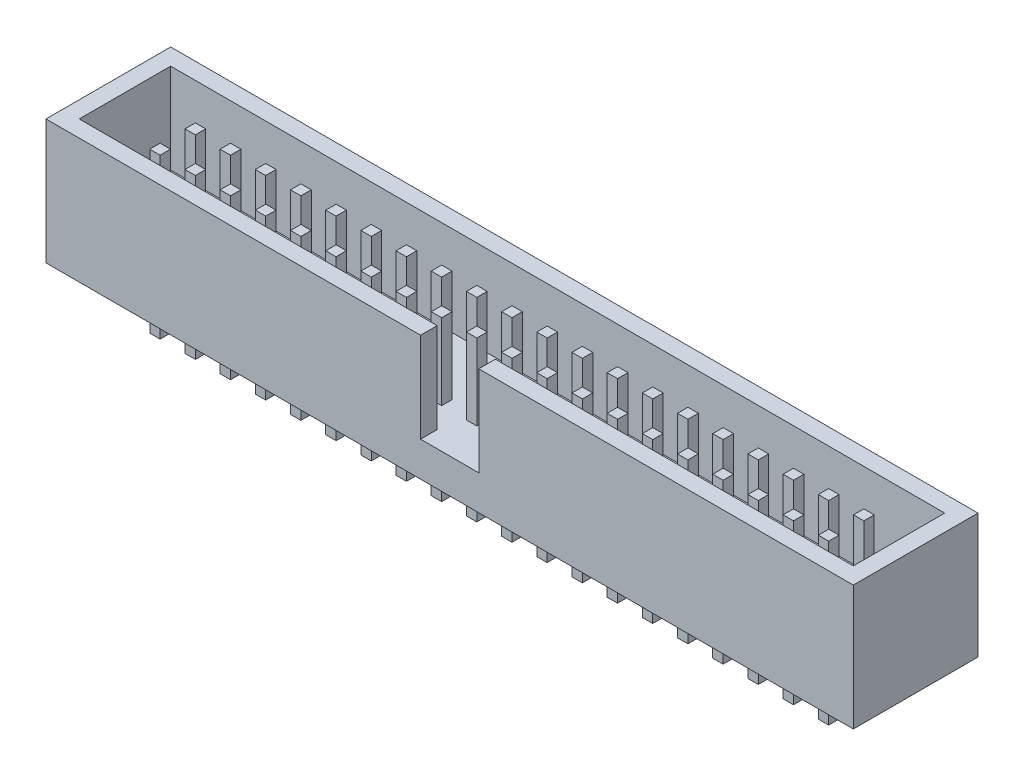
from build123d import *

# Parameters (mm, degrees)
SKETCH_1_W           = 58.28
SKETCH_1_H           = 9
EXTRUDE_1_DEPTH      = 9
SKETCH_2_W           = 55.88
SKETCH_2_H           = 6.6
CUT_EXTRUDE_1_DEPTH  = 6.5
SKETCH_3_W           = 4.2
SKETCH_3_H           = 6.5
CUT_EXTRUDE_2_DEPTH  = 6.5
EXTRUDE_2_DEPTH      = 3.5
EXTRUDE_2_DEPTH_BACK = 8
SKETCH_5_W           = 0.75
SKETCH_5_H           = 0.75


with BuildPart() as part:
    # 草图1 → 拉伸1 (new body)
    with BuildSketch(Plane(origin=(0, 0, 0), x_dir=(1, 0, 0), z_dir=(0, 1, 0))):
        Rectangle(SKETCH_1_W, SKETCH_1_H)
    extrude(amount=EXTRUDE_1_DEPTH)

    # 草图2 → 切除-拉伸1 (cut)
    with BuildSketch(Plane(origin=(0, 9, 0), x_dir=(-1, 0, 0), z_dir=(0, 1, 0))):
        Rectangle(SKETCH_2_W, SKETCH_2_H)
    extrude(amount=-CUT_EXTRUDE_1_DEPTH, mode=Mode.SUBTRACT)

    # 草图3 → 切除-拉伸2 (cut)
    with BuildSketch(Plane.XY.offset(4.5)):
        with Locations((0, 5.75)):
            Rectangle(SKETCH_3_W, SKETCH_3_H)
    extrude(amount=-CUT_EXTRUDE_2_DEPTH, mode=Mode.SUBTRACT)

    # 草图5 → 拉伸2 (add, two sides: drawn at the far end of the back side and taken through both)
    with BuildSketch(Plane.XZ.offset(-EXTRUDE_2_DEPTH_BACK)):
        with Locations((-1.27, 1.27)):
            Rectangle(SKETCH_5_W, SKETCH_5_H)
        with Locations((-3.81, 1.27)):
            Rectangle(SKETCH_5_W, SKETCH_5_H)
        with Locations((-6.35, 1.27)):
            Rectangle(SKETCH_5_W, SKETCH_5_H)
        with Locations((-8.89, 1.27)):
            Rectangle(SKETCH_5_W, SKETCH_5_H)
        with Locations((-8.89, -1.27)):
            Rectangle(SKETCH_5_W, SKETCH_5_H)
        with Locations((-6.35, -1.27)):
            Rectangle(SKETCH_5_W, SKETCH_5_H)
        with Locations((-3.81, -1.27)):
            Rectangle(SKETCH_5_W, SKETCH_5_H)
        with Locations((-1.27, -1.27)):
            Rectangle(SKETCH_5_W, SKETCH_5_H)
        with Locations((1.27, -1.27)):
            Rectangle(SKETCH_5_W, SKETCH_5_H)
        with Locations((3.81, -1.27)):
            Rectangle(SKETCH_5_W, SKETCH_5_H)
        with Locations((6.35, -1.27)):
            Rectangle(SKETCH_5_W, SKETCH_5_H)
        with Locations((8.89, -1.27)):
            Rectangle(SKETCH_5_W, SKETCH_5_H)
        with Locations((8.89, 1.27)):
            Rectangle(SKETCH_5_W, SKETCH_5_H)
        with Locations((6.35, 1.27)):
            Rectangle(SKETCH_5_W, SKETCH_5_H)
        with Locations((3.81, 1.27)):
            Rectangle(SKETCH_5_W, SKETCH_5_H)
        with Locations((1.27, 1.27)):
            Rectangle(SKETCH_5_W, SKETCH_5_H)
        with Locations((11.43, -1.27)):
            Rectangle(SKETCH_5_W, SKETCH_5_H)
        with Locations((11.43, 1.27)):
            Rectangle(SKETCH_5_W, SKETCH_5_H)
        with Locations((13.97, -1.27)):
            Rectangle(SKETCH_5_W, SKETCH_5_H)
        with Locations((13.97, 1.27)):
            Rectangle(SKETCH_5_W, SKETCH_5_H)
        with Locations((16.51, -1.27)):
            Rectangle(SKETCH_5_W, SKETCH_5_H)
        with Locations((16.51, 1.27)):
            Rectangle(SKETCH_5_W, SKETCH_5_H)
        with Locations((19.05, -1.27)):
            Rectangle(SKETCH_5_W, SKETCH_5_H)
        with Locations((19.05, 1.27)):
            Rectangle(SKETCH_5_W, SKETCH_5_H)
        with Locations((21.59, -1.27)):
            Rectangle(SKETCH_5_W, SKETCH_5_H)
        with Locations((21.59, 1.27)):
            Rectangle(SKETCH_5_W, SKETCH_5_H)
        with Locations((24.13, -1.27)):
            Rectangle(SKETCH_5_W, SKETCH_5_H)
        with Locations((24.13, 1.27)):
            Rectangle(SKETCH_5_W, SKETCH_5_H)
        with Locations((-11.43, 1.27)):
            Rectangle(SKETCH_5_W, SKETCH_5_H)
        with Locations((-11.43, -1.27)):
            Rectangle(SKETCH_5_W, SKETCH_5_H)
        with Locations((-13.97, 1.27)):
            Rectangle(SKETCH_5_W, SKETCH_5_H)
        with Locations((-13.97, -1.27)):
            Rectangle(SKETCH_5_W, SKETCH_5_H)
        with Locations((-16.51, 1.27)):
            Rectangle(SKETCH_5_W, SKETCH_5_H)
        with Locations((-16.51, -1.27)):
            Rectangle(SKETCH_5_W, SKETCH_5_H)
        with Locations((-19.05, 1.27)):
            Rectangle(SKETCH_5_W, SKETCH_5_H)
        with Locations((-19.05, -1.27)):
            Rectangle(SKETCH_5_W, SKETCH_5_H)
        with Locations((-21.59, 1.27)):
            Rectangle(SKETCH_5_W, SKETCH_5_H)
        with Locations((-21.59, -1.27)):
            Rectangle(SKETCH_5_W, SKETCH_5_H)
        with Locations((-24.13, 1.27)):
            Rectangle(SKETCH_5_W, SKETCH_5_H)
        with Locations((-24.13, -1.27)):
            Rectangle(SKETCH_5_W, SKETCH_5_H)
    extrude(amount=EXTRUDE_2_DEPTH + EXTRUDE_2_DEPTH_BACK)


solid = part.part
